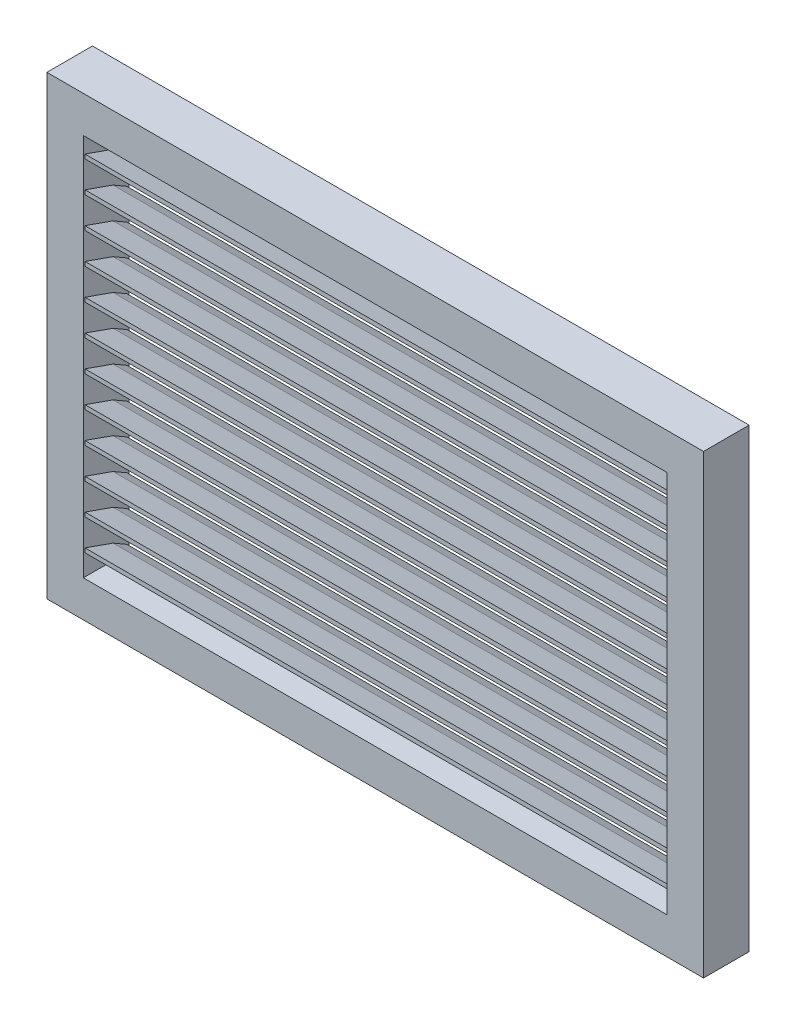
from build123d import *

# Parameters (mm, degrees)
SKETCH1_W           = 3600
SKETCH1_H           = 2500
SKETCH1_W_2         = 3200
SKETCH1_H_2         = 2100
BOSS_EXTRUDE4_DEPTH = 250
BOSS_EXTRUDE5_DEPTH = 3200
LPATTERN1_COUNT     = 12
LPATTERN1_PITCH     = 170


with BuildPart() as part:
    # Sketch1 → Boss-Extrude4 (new body)
    with BuildSketch(Plane.XY):
        with Locations((1800, 1250)):
            Rectangle(SKETCH1_W, SKETCH1_H)
        with Locations((1800, 1250)):
            Rectangle(SKETCH1_W_2, SKETCH1_H_2, mode=Mode.SUBTRACT)
    extrude(amount=BOSS_EXTRUDE4_DEPTH)

    # Sketch2 → Boss-Extrude5 (add)
    with BuildSketch(Plane.ZY.offset(-3400)):
        Polygon((241.257649794, 337.682377697), (87.566850397, 283.536038596), (10.739106486, 239.142435597), (20.652680925, 221.985964691), (87.566850397, 260.651177586), (241.257649794, 314.797516687), align=None)
    boss_extrude5 = extrude(amount=BOSS_EXTRUDE5_DEPTH)

    # LPattern1: Boss-Extrude5 ×12
    with Locations(*[(0, i * LPATTERN1_PITCH, 0) for i in range(1, LPATTERN1_COUNT)]):
        add(boss_extrude5)


solid = part.part
